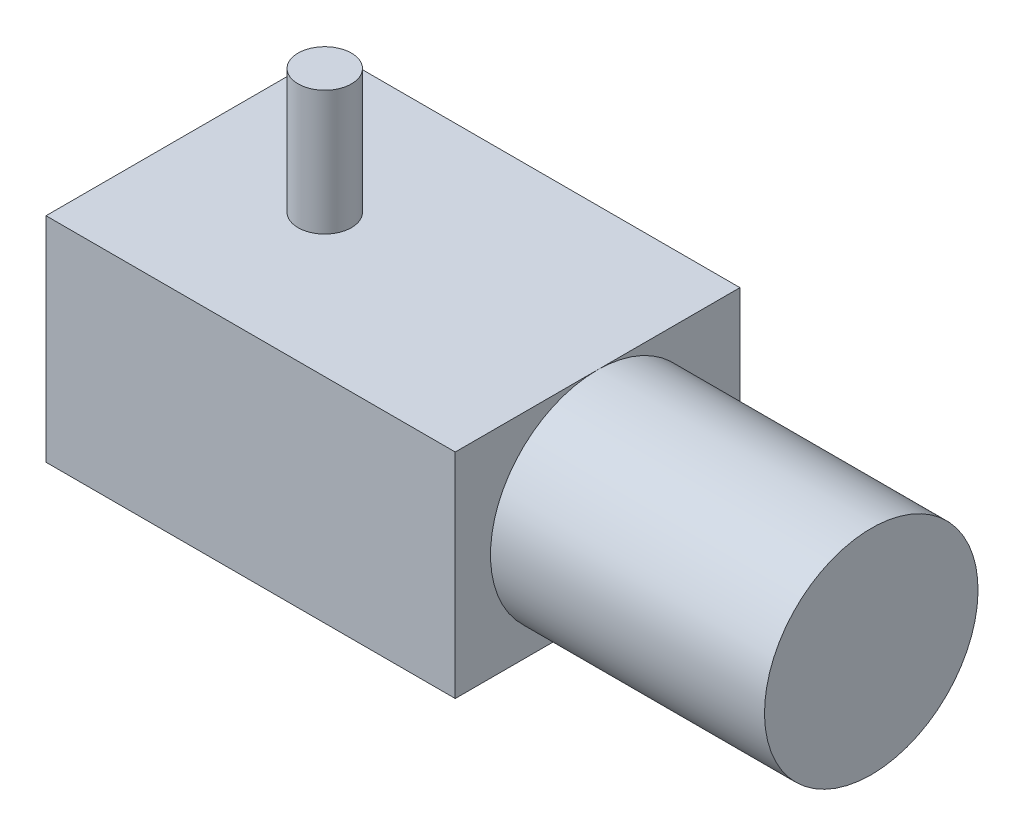
from build123d import *

# Parameters (mm, degrees)
SKETCH1_W           = 76.8
SKETCH1_H           = 32
BOSS_EXTRUDE1_DEPTH = 24
SKETCH2_R           = 3
BOSS_EXTRUDE2_DEPTH = 14
CUT_EXTRUDE1_DEPTH  = 30.8


with BuildPart() as part:
    # Sketch1 → Boss-Extrude1 (new body)
    with BuildSketch(Plane(origin=(0, 0, 0), x_dir=(1, 0, 0), z_dir=(0, 1, 0))):
        with Locations((-38.4, 16)):
            Rectangle(SKETCH1_W, SKETCH1_H)
    extrude(amount=BOSS_EXTRUDE1_DEPTH)

    # Sketch2 → Boss-Extrude2 (add)
    with BuildSketch(Plane(origin=(0, 24, 0), x_dir=(1, 0, 0), z_dir=(0, 1, 0))):
        with Locations(Location((-61.466666667, 16, 0), (0, 0, 270))):
            Circle(SKETCH2_R)
    extrude(amount=BOSS_EXTRUDE2_DEPTH)

    # Sketch3 → Cut-Extrude1 (cut)
    with BuildSketch(Plane(origin=(0, 0, 0), x_dir=(0, 0, -1), z_dir=(1, 0, 0))):
        with BuildLine():
            ThreePointArc((15.826247816, 0), (3.960387057, 12.066788737), (15.960575012, 24))
            Line((15.960575012, 24), (0, 24))
            Line((0, 24), (0, 0))
            Line((0, 0), (15.826247816, 0))
        make_face()
        with BuildLine():
            Line((32, 24), (15.960575012, 24))
            ThreePointArc((15.960575012, 24), (24.446122196, 20.485171272), (27.960950924, 11.999624088))
            ThreePointArc((27.960950924, 11.999624088), (24.493481869, 3.561702389), (16.094902207, 0))
            Line((16.094902207, 0), (32, 0))
            Line((32, 0), (32, 24))
        make_face()
    extrude(amount=-CUT_EXTRUDE1_DEPTH, mode=Mode.SUBTRACT)


solid = part.part
